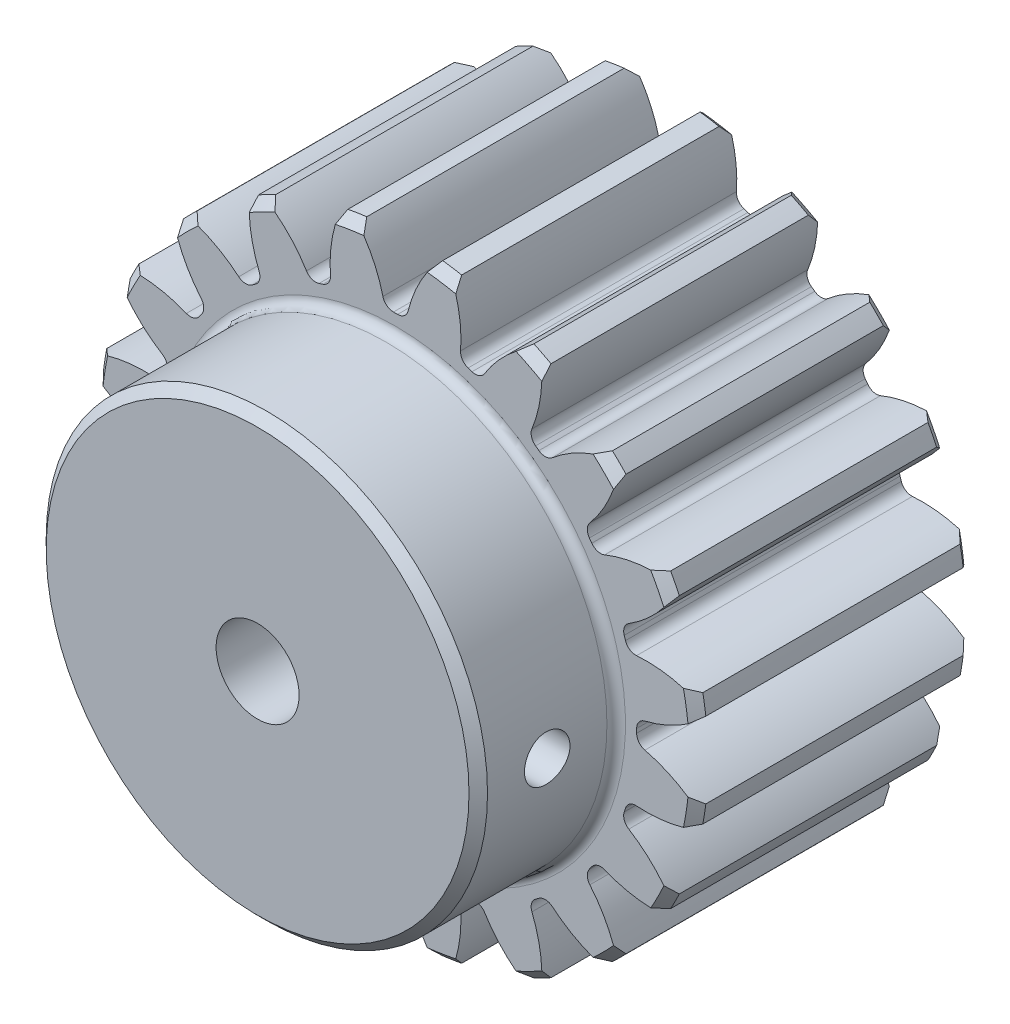
from build123d import *

# Parameters (mm, degrees)
BOSS_EXTRUDE1_DEPTH      = 10
BOSS_EXTRUDE1_DEPTH_BACK = 20
SKETCH3_R                = 22
SKETCH5_W                = 10
SKETCH5_H                = 6
SKETCH5_W_2              = 30
FILLET2_R                = 0.671010072
CHAMFER1_SIZE            = 0.671010072
CUT_EXTRUDE1_DEPTH       = 37.986484018
FILLET1_R                = 0.785398163
CIRPATTERN1_COUNT        = 20
FILLET1_OF_CIRPATTERN1_R = 0.785398163
SKETCH6_R                = 6.671010072
SKETCH6_R_2              = 3.0075
BOSS_EXTRUDE4_DEPTH      = 30
SKETCH9_W                = 1.65
SKETCH9_H                = 21.826990558


with BuildPart() as part:
    # Sketch3 → Boss-Extrude1 (new, two sides: drawn at the far end of the back side and taken through both)
    with BuildSketch(Plane.XY.offset(-BOSS_EXTRUDE1_DEPTH_BACK)):
        Circle(SKETCH3_R)
    extrude(amount=BOSS_EXTRUDE1_DEPTH + BOSS_EXTRUDE1_DEPTH_BACK)

    # Sketch5 → Cut-Revolve1 (revolve, cut)
    with BuildSketch(Plane(origin=(0, 0, 0), x_dir=(0, 0, -1), z_dir=(1, 0, 0)), mode=Mode.PRIVATE) as cut_revolve1_sk:
        with Locations((-5, 19)):
            Rectangle(SKETCH5_W, SKETCH5_H)
        with Locations((5, 3)):
            Rectangle(SKETCH5_W_2, SKETCH5_H)
    revolve(cut_revolve1_sk.sketch.rotate(Axis((0, 0, 10), (0, 0, -1)), 180), axis=Axis((0, 0, 10), (0, 0, -1)), mode=Mode.SUBTRACT)

    # Fillet2
    fillet2_edges = [part.edges().sort_by_distance(p)[0] for p in [
        (0, 16, 0),
    ]]
    fillet(fillet2_edges, radius=FILLET2_R)

    # Chamfer1
    chamfer1_edges = [part.edges().sort_by_distance(p)[0] for p in [
        (0, 6, 10),
        (0, 6, -20),
        (-22, 0, 0),
        (0, 16, 10),
        (-22, 0, -20),
    ]]
    chamfer(chamfer1_edges, length=CHAMFER1_SIZE)

    # Sketch4 → Cut-Extrude1 (cut, symmetric)
    with BuildSketch(Plane.XY):
        with BuildLine():
            Line((17.482366823, 0.785398163), (17.482366823, -0.785398163))
            ThreePointArc((17.482366823, -0.785398163), (19.776731225, -1.500099072), (21.826990558, -2.753630907))
            ThreePointArc((21.826990558, -2.753630907), (22, 0), (21.826990558, 2.753630907))
            ThreePointArc((21.826990558, 2.753630907), (19.776731225, 1.500099072), (17.482366823, 0.785398163))
        make_face()
    cut_extrude1 = extrude(amount=CUT_EXTRUDE1_DEPTH, both=True, mode=Mode.SUBTRACT)

    # Fillet1
    fillet1_edges = [part.edges().sort_by_distance(p)[0] for p in [
        (17.482366823, 0.785398163, -10),
        (17.482366823, -0.785398163, -10),
    ]]
    fillet(fillet1_edges, radius=FILLET1_R)

    # CirPattern1: Cut-Extrude1 ×20 about axis
    cirpattern1_axis = Axis((0, 0, 0), (0, 0, 1))
    for i in range(1, CIRPATTERN1_COUNT):
        add(cut_extrude1.rotate(cirpattern1_axis, i * 360 / CIRPATTERN1_COUNT), mode=Mode.SUBTRACT)

    # Fillet1 of CirPattern1
    fillet1_of_cirpattern1_edges = [part.edges().sort_by_distance(p)[0] for p in [
        (16.384017507, 6.149306491, -10),
        (16.869420267, 4.655390409, -10),
        (13.681886404, 10.911277855, -10),
        (14.605177319, 9.640476932, -10),
        (9.640476932, 14.605177319, -10),
        (10.911277855, 13.681886404, -10),
        (4.655390409, 16.869420267, -10),
        (6.149306491, 16.384017507, -10),
        (-0.785398163, 17.482366823, -10),
        (0.785398163, 17.482366823, -10),
        (-6.149306491, 16.384017507, -10),
        (-4.655390409, 16.869420267, -10),
        (-10.911277855, 13.681886404, -10),
        (-9.640476932, 14.605177319, -10),
        (-14.605177319, 9.640476932, -10),
        (-13.681886404, 10.911277855, -10),
        (-16.869420267, 4.655390409, -10),
        (-16.384017507, 6.149306491, -10),
        (-17.482366823, -0.785398163, -10),
        (-17.482366823, 0.785398163, -10),
        (-16.384017507, -6.149306491, -10),
        (-16.869420267, -4.655390409, -10),
        (-13.681886404, -10.911277855, -10),
        (-14.605177319, -9.640476932, -10),
        (-9.640476932, -14.605177319, -10),
        (-10.911277855, -13.681886404, -10),
        (-4.655390409, -16.869420267, -10),
        (-6.149306491, -16.384017507, -10),
        (0.785398163, -17.482366823, -10),
        (-0.785398163, -17.482366823, -10),
        (6.149306491, -16.384017507, -10),
        (4.655390409, -16.869420267, -10),
        (10.911277855, -13.681886404, -10),
        (9.640476932, -14.605177319, -10),
        (14.605177319, -9.640476932, -10),
        (13.681886404, -10.911277855, -10),
        (16.869420267, -4.655390409, -10),
        (16.384017507, -6.149306491, -10),
    ]]
    fillet(fillet1_of_cirpattern1_edges, radius=FILLET1_OF_CIRPATTERN1_R)

    # Sketch6 → Boss-Extrude4 (add, through all)
    with BuildSketch(Plane.XY.offset(10)):
        Circle(SKETCH6_R)
        Circle(SKETCH6_R_2, mode=Mode.SUBTRACT)
    extrude(amount=-BOSS_EXTRUDE4_DEPTH)

    # Sketch9 → M4x0.7 Tapped Hole1 (revolve, cut)
    with BuildSketch(Plane(origin=(0, 0, 5), x_dir=(0, 0, 1), z_dir=(0, 1, 0))):
        with Locations((0.825, 10.913495279)):
            Rectangle(SKETCH9_W, SKETCH9_H)
    revolve(axis=Axis((-6.35, 0, 5), (1, 0, 0)), mode=Mode.SUBTRACT)


solid = part.part
